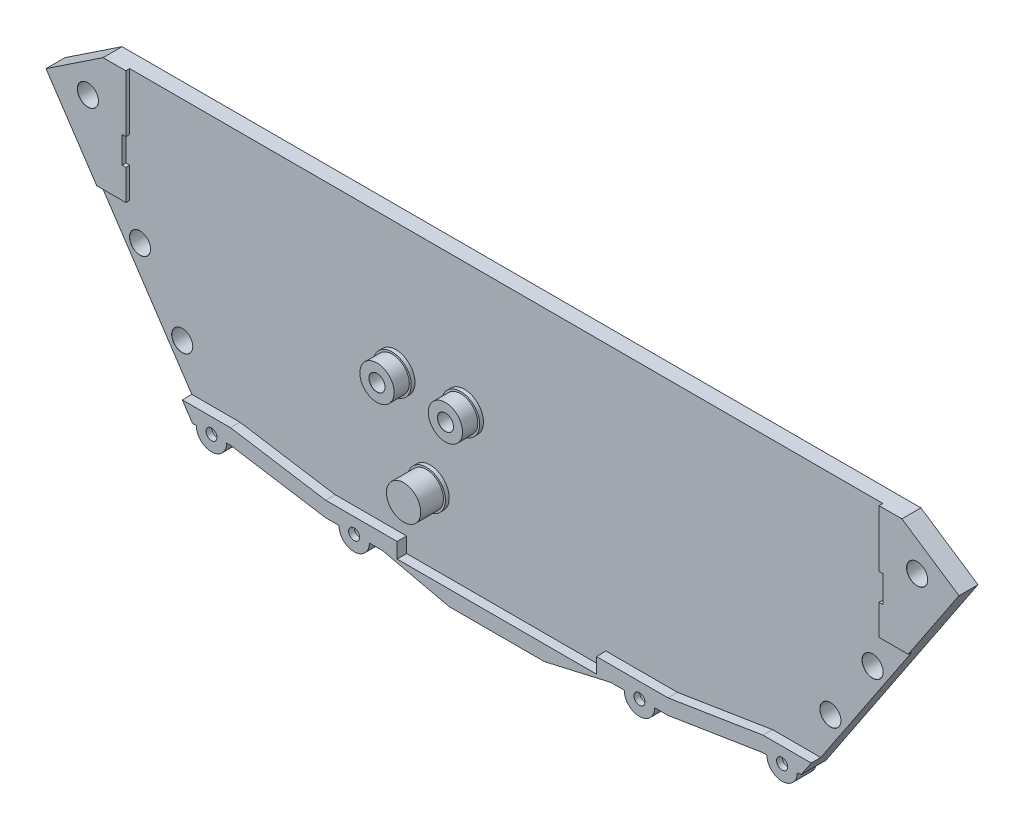
from build123d import *

# Parameters (mm, degrees)
EXTRUDE_1_DEPTH                = 4
EXTRUDE_2_DEPTH                = 1
HOLE_WIZARD_M5_1_D             = 5.5
HOLE_WIZARD_M5_1_CSINK_D       = 5.55
HOLE_WIZARD_M5_1_CSINK_ANGLE   = 90
EXTRUDE_START                  = -4
EXTRUDE_3_DEPTH                = 6.5
SKETCH_22_W                    = 52.393711498
SKETCH_22_H                    = 4
EXTRUDE_4_DEPTH                = 4
SKETCH_23_R                    = 4
EXTRUDE_5_DEPTH                = 5
HOLE_WIZARD_M2_5_1_D           = 2.9
HOLE_WIZARD_M2_5_1_DEPTH       = 10
HOLE_WIZARD_M2_5_1_CSINK_D     = 2.95
HOLE_WIZARD_M2_5_1_CSINK_ANGLE = 90
HOLE_WIZARD_M2_5_1_TIP         = 0.871247898
SKETCH_27_R                    = 2.5
CUT_EXTRUDE_4_DEPTH            = 5
SKETCH_28_R                    = 5
EXTRUDE_6_DEPTH                = 1
SKETCH_29_R                    = 4.5
EXTRUDE_7_DEPTH                = 6
SKETCH_30_R                    = 4.5
EXTRUDE_8_DEPTH                = 4
HOLE_WIZARD_M5_1_2_D           = 4.2
HOLE_WIZARD_M5_1_2_CSINK_D     = 4.25
HOLE_WIZARD_M5_1_2_CSINK_ANGLE = 90
HOLE_WIZARD_M5_2_D             = 5.5
HOLE_WIZARD_M5_2_DEPTH         = 10
HOLE_WIZARD_M5_2_CSINK_D       = 5.55
HOLE_WIZARD_M5_2_CSINK_ANGLE   = 90
HOLE_WIZARD_M5_2_TIP           = 1.652366702


with BuildPart() as part:
    # 草图2 → 凸台-拉伸1 (new body)
    with BuildSketch(Plane.XY):
        Polygon((80, 0), (-80, 0), (-120, 60), (-105, 70), (105, 70), (120, 60), align=None)
    extrude(amount=EXTRUDE_1_DEPTH)

    # 草图3 → 凸台-拉伸2 (add)
    with BuildSketch(Plane.XY.offset(4)):
        Polygon((105, 70), (99, 70), (99, 55), (100, 55), (100, 48), (99, 48), (99, 40), (106.666666667, 40), (120, 60), align=None)
        Polygon((-120, 60), (-105, 70), (-99, 70), (-99, 55), (-100, 55), (-100, 48), (-99, 48), (-99, 40), (-106.666666667, 40), align=None)
    extrude(amount=EXTRUDE_2_DEPTH)

    # Hole Wizard M5 _1 (through all)
    with Locations(Plane.XY.offset(5)):
        with Locations((-109, 59.5), (109, 59.5)):
            CounterSinkHole(HOLE_WIZARD_M5_1_D / 2, HOLE_WIZARD_M5_1_CSINK_D / 2, counter_sink_angle=HOLE_WIZARD_M5_1_CSINK_ANGLE)

    # 草图21 → 凸台-拉伸3 (add)
    with BuildSketch(Plane.XY.offset(4).offset(EXTRUDE_START)):
        Polygon((-70, 0), (-45, -4), (-30, -4), (-12.5, -8), (12.5, -8), (30, -4), (45, -4), (70, 0), (80, 0), (82.666666667, 4), (70, 4), (45, 0), (26.196855749, 0), (26.196855749, -4), (-26.196855749, -4), (-26.196855749, 0), (-45, 0), (-70, 4), (-82.666666667, 4), (-80, 0), align=None)
    extrude(amount=EXTRUDE_3_DEPTH)

    # 草图22 → 凸台-拉伸4 (add)
    with BuildSketch(Plane.XZ):
        with Locations((0, 2)):
            Rectangle(SKETCH_22_W, SKETCH_22_H)
    extrude(amount=EXTRUDE_4_DEPTH)

    # 草图23 → 凸台-拉伸5 (add)
    with BuildSketch(Plane.XY.offset(6.5)):
        with Locations((-75, 0)):
            Circle(SKETCH_23_R)
        with Locations((-37.5, -4)):
            Circle(SKETCH_23_R)
        with Locations((37.5, -4)):
            Circle(SKETCH_23_R)
        with Locations((75, 0)):
            Circle(SKETCH_23_R)
    extrude(amount=-EXTRUDE_5_DEPTH)

    # M2.5 间隙孔1
    with Locations(Plane(origin=(0, 0, 0), x_dir=(-1, 0, 0), z_dir=(0, 0, -1))):
        with Locations((-75, 0), (-37.5, -4), (37.5, -4), (75, 0)):
            CounterSinkHole(HOLE_WIZARD_M2_5_1_D / 2, HOLE_WIZARD_M2_5_1_CSINK_D / 2, depth=HOLE_WIZARD_M2_5_1_DEPTH, counter_sink_angle=HOLE_WIZARD_M2_5_1_CSINK_ANGLE)
            with Locations((0, 0, -(HOLE_WIZARD_M2_5_1_DEPTH + HOLE_WIZARD_M2_5_1_TIP / 2))):  # 118° drill point
                Cone(0, HOLE_WIZARD_M2_5_1_D / 2, HOLE_WIZARD_M2_5_1_TIP, mode=Mode.SUBTRACT)

    # 草图27 → 切除-拉伸4 (cut)
    with BuildSketch(Plane(origin=(0, 0, 0), x_dir=(-1, 0, 0), z_dir=(0, 0, -1))):
        with Locations((-75, 0)):
            Circle(SKETCH_27_R)
        with Locations((-37.5, -4)):
            Circle(SKETCH_27_R)
        with Locations((75, 0)):
            Circle(SKETCH_27_R)
        with Locations((37.5, -4)):
            Circle(SKETCH_27_R)
    extrude(amount=-CUT_EXTRUDE_4_DEPTH, mode=Mode.SUBTRACT)

    # 草图28 → 凸台-拉伸6 (add)
    with BuildSketch(Plane.XY.offset(4)):
        with Locations(Location((-20, 14.25, 0), (0, 0, 180))):
            Circle(SKETCH_28_R)
        with Locations(Location((-29, 36, 0), (0, 0, 180))):
            Circle(SKETCH_28_R)
        with Locations(Location((-11, 36, 0), (0, 0, 180))):
            Circle(SKETCH_28_R)
    extrude(amount=EXTRUDE_6_DEPTH)

    # 草图29 → 凸台-拉伸7 (add)
    with BuildSketch(Plane.XY.offset(5)):
        with Locations((-20, 14.25)):
            Circle(SKETCH_29_R)
    extrude(amount=EXTRUDE_7_DEPTH)

    # 草图30 → 凸台-拉伸8 (add)
    with BuildSketch(Plane.XY.offset(5)):
        with Locations((-11, 36)):
            Circle(SKETCH_30_R)
        with Locations((-29, 36)):
            Circle(SKETCH_30_R)
    extrude(amount=EXTRUDE_8_DEPTH)

    # Hole Wizard M5 _1 2 (through all)
    with Locations(Plane.XY.offset(9)):
        with Locations((-29, 36), (-11, 36)):
            CounterSinkHole(HOLE_WIZARD_M5_1_2_D / 2, HOLE_WIZARD_M5_1_2_CSINK_D / 2, counter_sink_angle=HOLE_WIZARD_M5_1_2_CSINK_ANGLE)

    # M5 间隙孔2
    with Locations(Plane.XY.offset(4)):
        with Locations((-96.286602224, 31.641005887), (-85.192598299, 15), (96.286602224, 31.641005887), (85.192598299, 15)):
            CounterSinkHole(HOLE_WIZARD_M5_2_D / 2, HOLE_WIZARD_M5_2_CSINK_D / 2, depth=HOLE_WIZARD_M5_2_DEPTH, counter_sink_angle=HOLE_WIZARD_M5_2_CSINK_ANGLE)
            with Locations((0, 0, -(HOLE_WIZARD_M5_2_DEPTH + HOLE_WIZARD_M5_2_TIP / 2))):  # 118° drill point
                Cone(0, HOLE_WIZARD_M5_2_D / 2, HOLE_WIZARD_M5_2_TIP, mode=Mode.SUBTRACT)


solid = part.part
